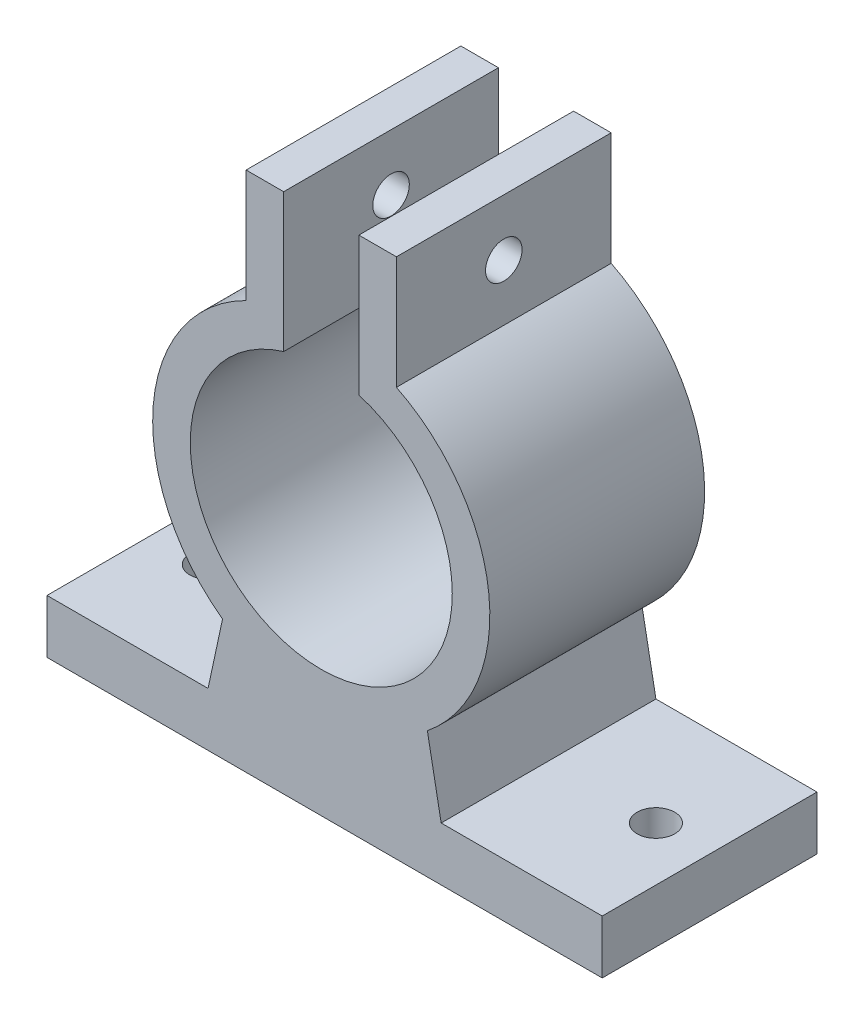
from build123d import *

# Parameters (mm, degrees)
Y_KSEKLIK_EKSTR_ZYON1_DEPTH = 20
IZIM6_R                     = 1.7
KES_EKSTR_ZYON2_DEPTH       = 20
KES_EKSTR_ZYON3_DEPTH       = 46
Y_KSEKLIK_EKSTR_ZYON2_DEPTH = 20
IZIM9_R                     = 1.7
IZIM9_R_2                   = 1.75
KES_EKSTR_ZYON4_DEPTH       = 46


with BuildPart() as part:
    # Çizim1 → Yükseklik-Ekstrüzyon1 (new body)
    with BuildSketch(Plane.XY):
        with BuildLine():
            Line((-3.5, 11.687172455), (-3.5, 20.580454312))
            Line((-3.5, 20.580454312), (-3.5, 24.580454312))
            Line((-3.5, 24.580454312), (-7, 24.580454312))
            Line((-7, 24.580454312), (-7, 20.580454312))
            Line((-7, 20.580454312), (-7, 14.053113534))
            ThreePointArc((-7, 14.053113534), (-15.647613909, 1.281475299), (-9.19317791, -12.726958785))
            Line((-9.19317791, -12.726958785), (-15.7, -43))
            Line((-15.7, -43), (15.7, -43))
            Line((15.7, -43), (9.881801455, -12.2))
            ThreePointArc((9.881801455, -12.2), (15.606258285, 1.713097297), (7, 14.053113534))
            Line((7, 14.053113534), (7, 20.580454312))
            Line((7, 20.580454312), (7, 24.580454312))
            Line((7, 24.580454312), (3.5, 24.580454312))
            Line((3.5, 24.580454312), (3.5, 20.580454312))
            Line((3.5, 20.580454312), (3.5, 11.687172455))
            ThreePointArc((3.5, 11.687172455), (0, -12.2), (-3.5, 11.687172455))
        make_face()
    extrude(amount=Y_KSEKLIK_EKSTR_ZYON1_DEPTH)

    # Çizim6 → Kes-Ekstrüzyon2 (cut)
    with BuildSketch(Plane(origin=(7, 0, 0), x_dir=(0, 0, -1), z_dir=(1, 0, 0))):
        with Locations((-10, 19.316783923)):
            Circle(IZIM6_R)
    extrude(amount=-KES_EKSTR_ZYON2_DEPTH, mode=Mode.SUBTRACT)

    # Çizim7 → Kes-Ekstrüzyon3 (cut)
    with BuildSketch(Plane.XY.offset(20)):
        Polygon((-15.7, -43), (-15.7, -19), (23.821750054, -19), (23.821750054, -48.375532492), (-15.7, -48.375532492), align=None)
    extrude(amount=-KES_EKSTR_ZYON3_DEPTH, mode=Mode.SUBTRACT)

    # Çizim8 → Yükseklik-Ekstrüzyon2 (add)
    with BuildSketch(Plane.XY.offset(20)):
        Polygon((-10.541491839, -19), (-25.541491839, -19), (-25.541491839, -24), (11.166338796, -24), (26.166338796, -24), (26.166338796, -19), (11.166338796, -19), align=None)
    extrude(amount=-Y_KSEKLIK_EKSTR_ZYON2_DEPTH)

    # Çizim9 → Kes-Ekstrüzyon4 (cut)
    with BuildSketch(Plane(origin=(0, -19, 0), x_dir=(1, 0, 0), z_dir=(0, 1, 0))):
        with Locations(Location((-20.541491839, -10, 0), (0, 0, 270))):
            Circle(IZIM9_R)
        with Locations(Location((21.166338796, -10, 0), (0, 0, 270))):
            Circle(IZIM9_R_2)
    extrude(amount=-KES_EKSTR_ZYON4_DEPTH, mode=Mode.SUBTRACT)


solid = part.part
